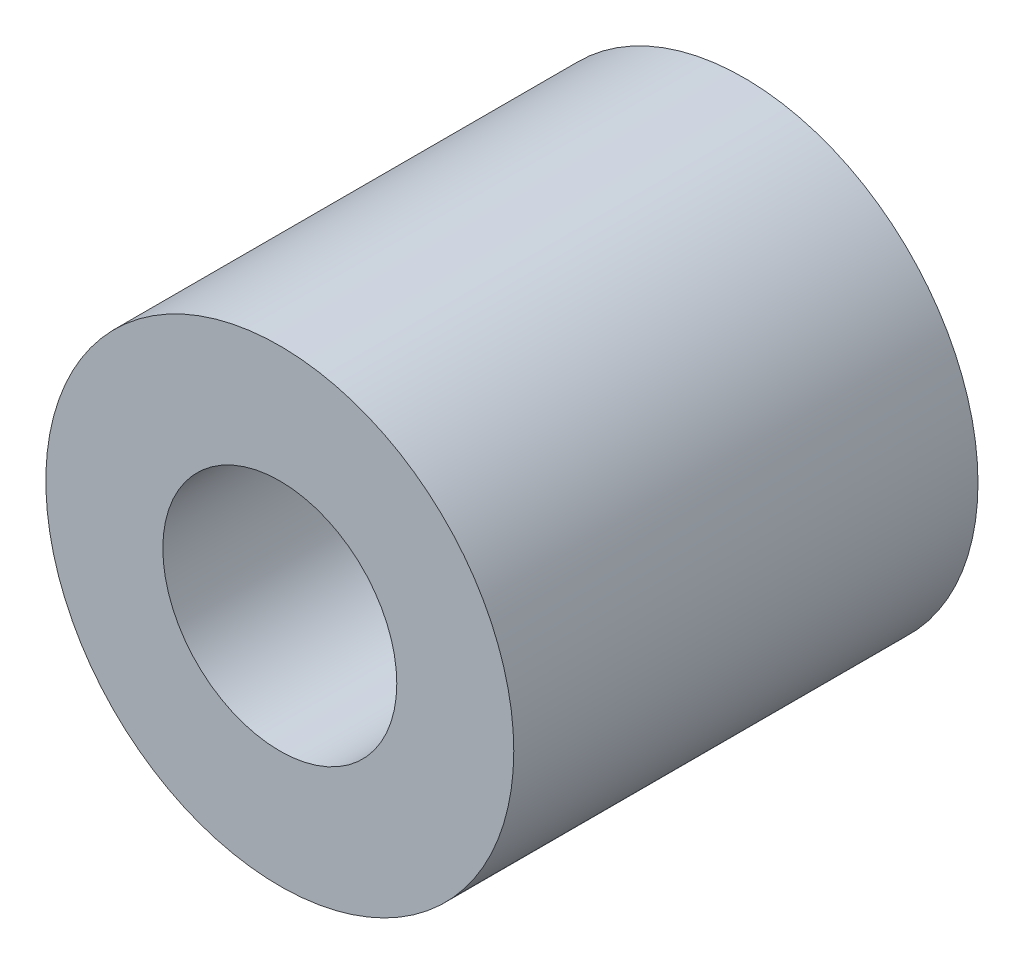
from build123d import *

# Parameters (mm, degrees)
BOSS_EXTRUDE1_DEPTH      = 3.175
BOSS_EXTRUDE1_DEPTH_BACK = 3.175
SKETCH5_R                = 3.2004
SKETCH5_R_2              = 1.6002


with BuildPart() as part:
    # Sketch5 → Boss-Extrude1 (new, two sides: drawn at the far end of the back side and taken through both)
    with BuildSketch(Plane.XY.offset(-BOSS_EXTRUDE1_DEPTH_BACK)):
        Circle(SKETCH5_R)
        Circle(SKETCH5_R_2, mode=Mode.SUBTRACT)
    extrude(amount=BOSS_EXTRUDE1_DEPTH + BOSS_EXTRUDE1_DEPTH_BACK)


solid = part.part
